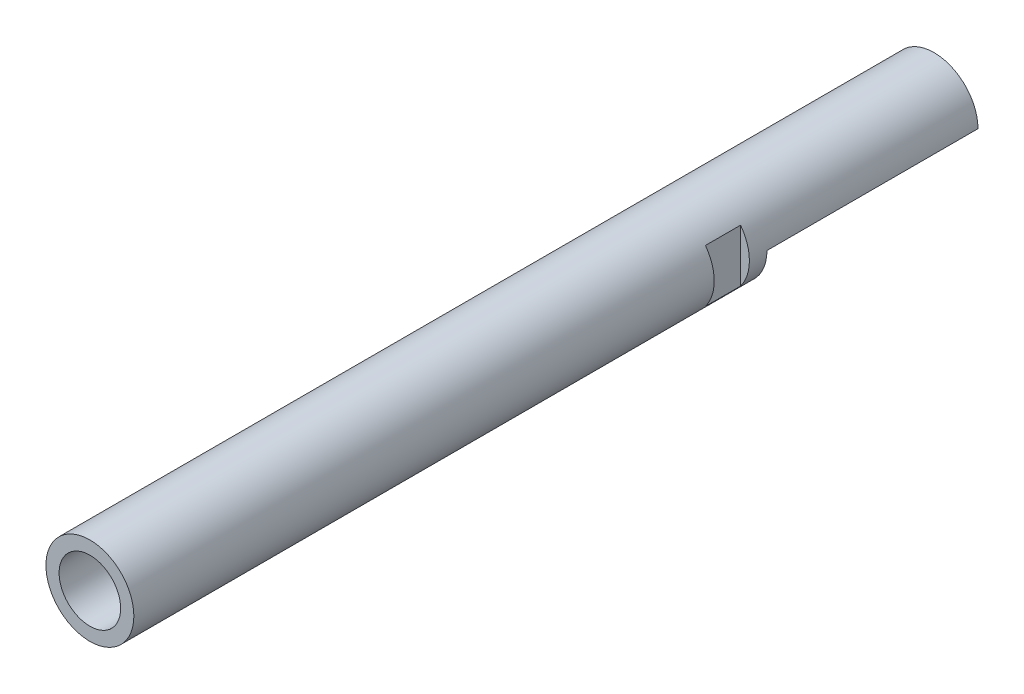
from build123d import *

# Parameters (mm, degrees)
SKETCH1_R                           = 15.875
SKETCH1_R_2                         = 9.525
BOSS_EXTRUDE1_DEPTH                 = 304.8
SKETCH2_R                           = 11.1125
CUT_EXTRUDE1_DEPTH                  = 19.05
CUT_EXTRUDE4_DEPTH                  = 76.2
CUT_EXTRUDE7_DEPTH                  = 12.7
CUT_EXTRUDE8_REACH                  = 308.548
CUT_EXTRUDE8_END_RADIUS             = 9.525
CUT_EXTRUDE8_DIRECTION_2_REACH      = 308.548
CUT_EXTRUDE8_DIRECTION_2_END_RADIUS = 15.875


with BuildPart() as part:
    # Sketch1 → Boss-Extrude1 (new body)
    with BuildSketch(Plane.XY):
        with Locations(Location((0, 0, 0), (0, 0, 180))):
            Circle(SKETCH1_R)
        with Locations(Location((0, 0, 0), (0, 0, 180))):
            Circle(SKETCH1_R_2, mode=Mode.SUBTRACT)
    extrude(amount=BOSS_EXTRUDE1_DEPTH)

    # Sketch2 → Cut-Extrude1 (cut)
    with BuildSketch(Plane.XY.offset(304.8)):
        Circle(SKETCH2_R)
    extrude(amount=-CUT_EXTRUDE1_DEPTH, mode=Mode.SUBTRACT)

    # Sketch6 → Cut-Extrude4 (cut)
    with BuildSketch(Plane(origin=(0, 0, 0), x_dir=(-1, 0, 0), z_dir=(0, 0, -1))):
        with BuildLine():
            Line((15.875, 0), (-15.875, 0))
            ThreePointArc((-15.875, 0), (0, -15.875), (15.875, 0))
        make_face()
    extrude(amount=-CUT_EXTRUDE4_DEPTH, mode=Mode.SUBTRACT)

    # Sketch8 → Cut-Extrude7 (cut)
    with BuildSketch(Plane(origin=(0, 0, 82.55), x_dir=(-1, 0, 0), z_dir=(0, 0, -1))):
        with BuildLine():
            ThreePointArc((-9.525, -12.7), (0, -15.875), (9.525, -12.7))
            Line((9.525, -12.7), (-9.525, -12.7))
        make_face()
        with BuildLine():
            Line((-12.7, -9.525), (-12.7, 9.525))
            ThreePointArc((-12.7, 9.525), (-15.875, 0), (-12.7, -9.525))
        make_face()
    extrude(amount=-CUT_EXTRUDE7_DEPTH, mode=Mode.SUBTRACT)

    # Cut-Extrude8: up to this cylinder (the profile starts outside it)
    cut_extrude8_end = Plane(origin=(0, 0, 171.45), z_dir=(0, 0, -1)) * Cylinder(CUT_EXTRUDE8_END_RADIUS, 637.146, mode=Mode.PRIVATE)
    # Sketch9 → Cut-Extrude8 (cut, up to the surface)
    with BuildSketch(Plane.XZ.offset(12.7), mode=Mode.PRIVATE) as cut_extrude8_sk1:
        with BuildLine():
            ThreePointArc((0, 174.625), (-3.175, 171.45), (0, 168.275))
            Line((0, 168.275), (0, 174.625))
        make_face()
    cut_extrude8_tool1 = extrude(cut_extrude8_sk1.sketch, amount=-CUT_EXTRUDE8_REACH, mode=Mode.PRIVATE) - cut_extrude8_end
    add(cut_extrude8_tool1.solids().sort_by_distance((-1.347512, -12.7, 171.45))[0], mode=Mode.SUBTRACT)
    # Sketch9 → Cut-Extrude8 (cut, up to the surface)
    with BuildSketch(Plane.XZ.offset(12.7), mode=Mode.PRIVATE) as cut_extrude8_sk2:
        with BuildLine():
            Line((0, 174.625), (0, 168.275))
            ThreePointArc((0, 168.275), (2.24506403, 169.20493597), (3.175, 171.45))
            ThreePointArc((3.175, 171.45), (2.24506403, 173.69506403), (0, 174.625))
        make_face()
    cut_extrude8_tool2 = extrude(cut_extrude8_sk2.sketch, amount=-CUT_EXTRUDE8_REACH, mode=Mode.PRIVATE) - cut_extrude8_end
    add(cut_extrude8_tool2.solids().sort_by_distance((1.347512, -12.7, 171.45))[0], mode=Mode.SUBTRACT)
    # Sketch9 → Cut-Extrude8 (cut, up to the surface)
    with BuildSketch(Plane.XZ.offset(12.7), mode=Mode.PRIVATE) as cut_extrude8_sk3:
        with BuildLine():
            ThreePointArc((0, 174.625), (-3.175, 171.45), (0, 168.275))
            Line((0, 168.275), (0, 174.625))
        make_face()
    cut_extrude8_tool3 = extrude(cut_extrude8_sk3.sketch, amount=-CUT_EXTRUDE8_REACH, mode=Mode.PRIVATE) - cut_extrude8_end
    add(cut_extrude8_tool3.solids().sort_by_distance((-1.347512, -12.7, 171.45))[0], mode=Mode.SUBTRACT)
    # Sketch9 → Cut-Extrude8 (cut, up to the surface)
    with BuildSketch(Plane.XZ.offset(12.7), mode=Mode.PRIVATE) as cut_extrude8_sk4:
        with BuildLine():
            Line((0, 174.625), (0, 168.275))
            ThreePointArc((0, 168.275), (2.24506403, 169.20493597), (3.175, 171.45))
            ThreePointArc((3.175, 171.45), (2.24506403, 173.69506403), (0, 174.625))
        make_face()
    cut_extrude8_tool4 = extrude(cut_extrude8_sk4.sketch, amount=-CUT_EXTRUDE8_REACH, mode=Mode.PRIVATE) - cut_extrude8_end
    add(cut_extrude8_tool4.solids().sort_by_distance((1.347512, -12.7, 171.45))[0], mode=Mode.SUBTRACT)

    # Cut-Extrude8 direction 2: up to this cylinder (the profile starts inside it)
    cut_extrude8_direction_2_end = Plane(origin=(0, 0, 171.45), z_dir=(0, 0, -1)) * Cylinder(CUT_EXTRUDE8_DIRECTION_2_END_RADIUS, 649.846, mode=Mode.PRIVATE)
    # Sketch9 → Cut-Extrude8 direction 2 (cut, up to the surface)
    with BuildSketch(Plane.XZ.offset(12.7), mode=Mode.PRIVATE) as cut_extrude8_direction_2_sk1:
        with BuildLine():
            ThreePointArc((0, 174.625), (-3.175, 171.45), (0, 168.275))
            Line((0, 168.275), (0, 174.625))
        make_face()
    cut_extrude8_direction_2_tool1 = extrude(cut_extrude8_direction_2_sk1.sketch, amount=CUT_EXTRUDE8_DIRECTION_2_REACH, mode=Mode.PRIVATE) & cut_extrude8_direction_2_end
    add(cut_extrude8_direction_2_tool1.solids().sort_by_distance((-1.347512, -12.7, 171.45))[0], mode=Mode.SUBTRACT)
    # Sketch9 → Cut-Extrude8 direction 2 (cut, up to the surface)
    with BuildSketch(Plane.XZ.offset(12.7), mode=Mode.PRIVATE) as cut_extrude8_direction_2_sk2:
        with BuildLine():
            Line((0, 174.625), (0, 168.275))
            ThreePointArc((0, 168.275), (2.24506403, 169.20493597), (3.175, 171.45))
            ThreePointArc((3.175, 171.45), (2.24506403, 173.69506403), (0, 174.625))
        make_face()
    cut_extrude8_direction_2_tool2 = extrude(cut_extrude8_direction_2_sk2.sketch, amount=CUT_EXTRUDE8_DIRECTION_2_REACH, mode=Mode.PRIVATE) & cut_extrude8_direction_2_end
    add(cut_extrude8_direction_2_tool2.solids().sort_by_distance((1.347512, -12.7, 171.45))[0], mode=Mode.SUBTRACT)
    # Sketch9 → Cut-Extrude8 direction 2 (cut, up to the surface)
    with BuildSketch(Plane.XZ.offset(12.7), mode=Mode.PRIVATE) as cut_extrude8_direction_2_sk3:
        with BuildLine():
            ThreePointArc((0, 174.625), (-3.175, 171.45), (0, 168.275))
            Line((0, 168.275), (0, 174.625))
        make_face()
    cut_extrude8_direction_2_tool3 = extrude(cut_extrude8_direction_2_sk3.sketch, amount=CUT_EXTRUDE8_DIRECTION_2_REACH, mode=Mode.PRIVATE) & cut_extrude8_direction_2_end
    add(cut_extrude8_direction_2_tool3.solids().sort_by_distance((-1.347512, -12.7, 171.45))[0], mode=Mode.SUBTRACT)
    # Sketch9 → Cut-Extrude8 direction 2 (cut, up to the surface)
    with BuildSketch(Plane.XZ.offset(12.7), mode=Mode.PRIVATE) as cut_extrude8_direction_2_sk4:
        with BuildLine():
            Line((0, 174.625), (0, 168.275))
            ThreePointArc((0, 168.275), (2.24506403, 169.20493597), (3.175, 171.45))
            ThreePointArc((3.175, 171.45), (2.24506403, 173.69506403), (0, 174.625))
        make_face()
    cut_extrude8_direction_2_tool4 = extrude(cut_extrude8_direction_2_sk4.sketch, amount=CUT_EXTRUDE8_DIRECTION_2_REACH, mode=Mode.PRIVATE) & cut_extrude8_direction_2_end
    add(cut_extrude8_direction_2_tool4.solids().sort_by_distance((1.347512, -12.7, 171.45))[0], mode=Mode.SUBTRACT)


solid = part.part
